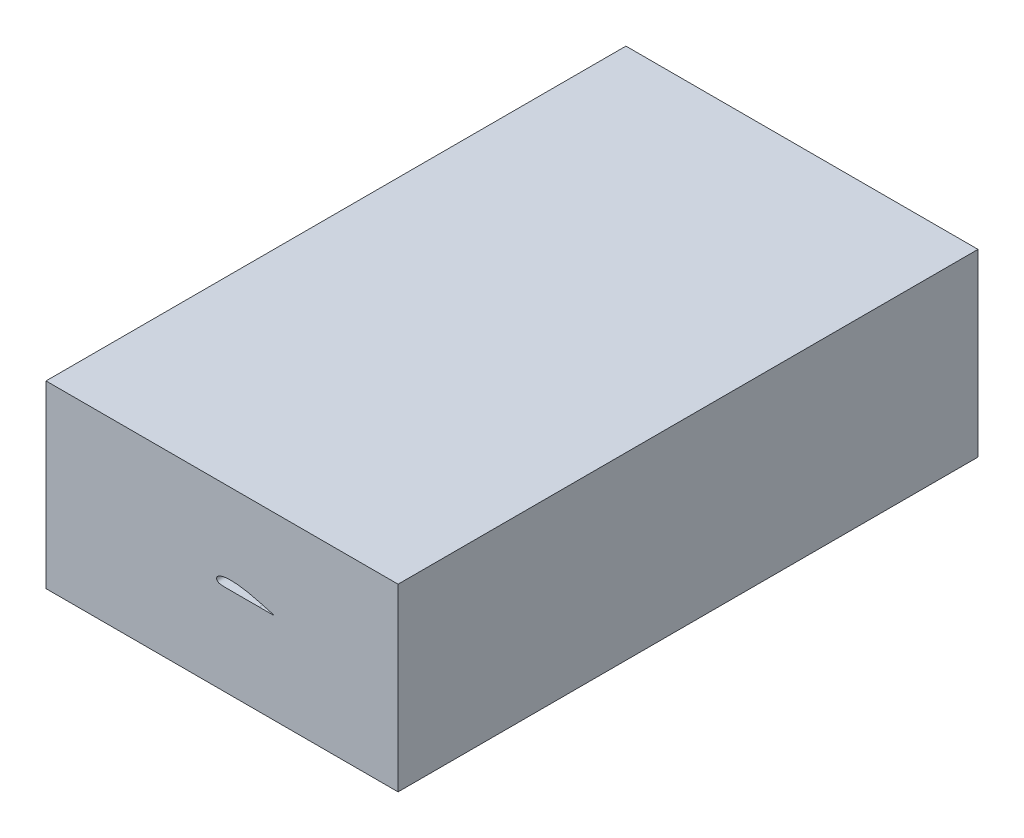
from build123d import *

# Parameters (mm, degrees)
SKETCH1_W           = 728.507712526
SKETCH1_H           = 372.247612808
BOSS_EXTRUDE1_DEPTH = 1200


with BuildPart() as part:
    # Sketch1 → Boss-Extrude1 (new body)
    with BuildSketch(Plane.XY):
        with Locations((364.253856263, 18.552453849)):
            Rectangle(SKETCH1_W, SKETCH1_H)
        with BuildLine():
            Line((441.393772372, 20.11245238), (470.720248748, 20.11245238))
            ThreePointArc((470.720248748, 20.11245238), (471.215775755, 20.545721687), (470.85251619, 21.094640438))
            Line((470.85251619, 21.094640438), (442.557049848, 28.856277993))
            add(Edge.make_bspline(
                [(441.393772372, 20.11245238), (437.816630749, 20.105643074), (430.662185952, 20.093254902), (419.931476298, 20.073638873), (410.989397892, 20.05802128), (403.835453794, 20.044763259), (398.470497743, 20.035035638), (393.10446141, 20.024425958), (387.735021397, 20.017659911), (383.274859524, 20.009444007), (379.696108674, 19.996368347), (376.991001378, 19.994447782), (374.271249485, 20.010918971), (371.530679735, 20.056360098), (369.228950932, 20.131407076), (367.378711377, 20.219984968), (365.978183778, 20.304620288), (364.578709921, 20.410081097), (363.214024728, 20.526416591), (361.971898146, 20.65201194), (360.904853145, 20.805577699), (360.069783324, 20.956248021), (359.288045988, 21.130261844), (358.640116289, 21.281010932), (357.765467063, 21.506816056), (356.839748986, 21.871835881), (356.055967315, 22.286834279), (355.325142217, 22.811112843), (354.788881726, 23.301715107), (354.347839516, 23.793022868), (353.998210399, 24.262418144), (353.695602528, 24.752886461), (353.365330175, 25.450623284), (353.111643283, 26.298326889), (352.961298812, 27.649941627), (353.227738955, 28.932944297), (353.586282933, 29.767186255), (353.964999314, 30.449203447), (354.389957132, 31.025585157), (354.855699671, 31.552849553), (355.354503463, 32.044209503), (355.820762746, 32.475335753), (356.552615658, 33.103064875), (357.389050585, 33.706898074), (358.216447641, 34.21460014), (359.287698264, 34.784145271), (360.572839349, 35.352857227), (362.056434922, 35.895767331), (363.479940401, 36.349485655), (364.908429326, 36.753895892), (366.827818433, 37.231436262), (369.210683302, 37.706967221), (372.066182641, 38.140016342), (374.963490259, 38.431919098), (378.7767391, 38.631004567), (383.377043684, 38.645396216), (388.865337546, 38.535909849), (394.412818539, 38.20453267), (401.720197274, 37.488657384), (410.779849111, 36.19753981), (421.486806006, 34.110578028), (432.09991262, 31.671596216), (439.072672673, 29.812066189), (442.557049848, 28.856277993)],
                knots=[0, 0, 0, 0, 0.062498476, 0.124996951, 0.187495427, 0.218744665, 0.249993902, 0.28124314, 0.312492378, 0.343741616, 0.359366235, 0.374990854, 0.390615473, 0.406240092, 0.42186471, 0.42967702, 0.437489329, 0.445301639, 0.453113948, 0.460926258, 0.464832412, 0.468738567, 0.472644722, 0.476550877, 0.480457031, 0.482410109, 0.484363186, 0.486316263, 0.488269341, 0.48924588, 0.490222418, 0.491198957, 0.492175496, 0.493152034, 0.494128573, 0.49608165, 0.497058189, 0.498034728, 0.499987805, 0.501940882, 0.50389396, 0.507800114, 0.511706269, 0.515612424, 0.519518579, 0.523424733, 0.531237043, 0.539049352, 0.546861662, 0.554673971, 0.562486281, 0.5781109, 0.593735518, 0.609360137, 0.624984756, 0.656233994, 0.687483232, 0.71873247, 0.749981707, 0.812480183, 0.874978659, 0.937477134, 0.99997561, 0.99997561, 0.99997561, 0.99997561], degree=3))
        make_face(mode=Mode.SUBTRACT)
    extrude(amount=BOSS_EXTRUDE1_DEPTH)


solid = part.part
